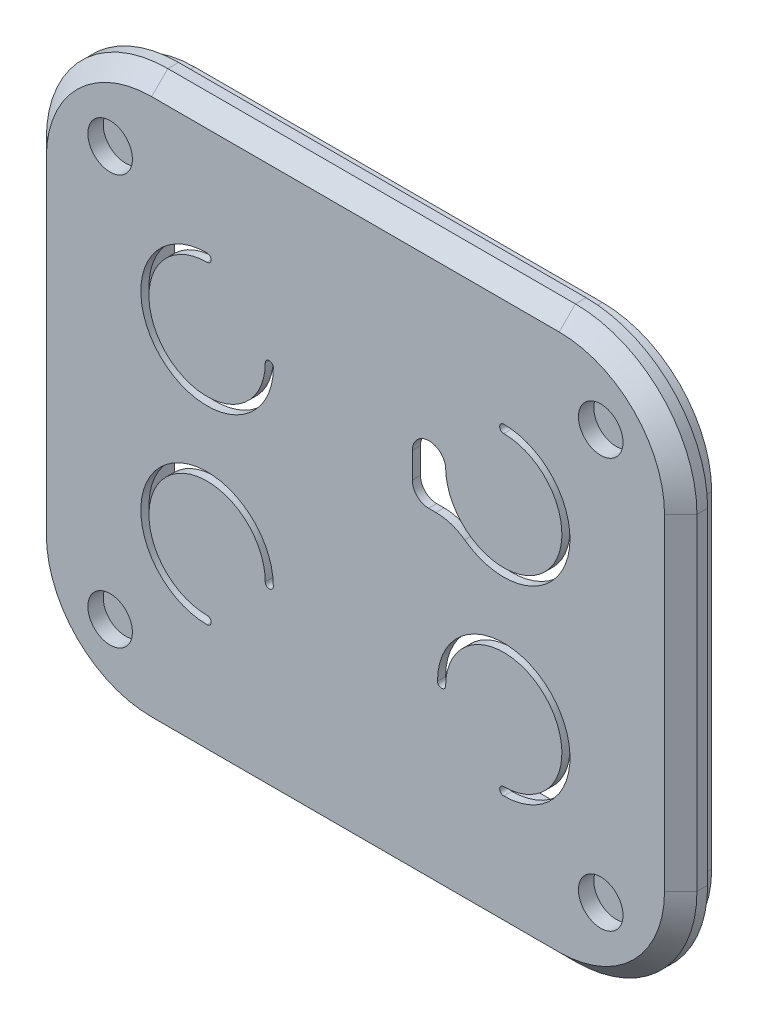
from build123d import *

# Parameters (mm, degrees)
FLEXTURE_DEPTH                 = 1
GENERAL_START                  = -4.32
GENERAL_DEPTH                  = 4.32
CHANFREIN1_SIZE                = 2
ENL_V_MAT_EXTRU_1_DEPTH        = 2
ESQUISSE2_R                    = 1.75
PASSAGE_VIS_DEPTH              = 54.536972272
LAMAGE_START                   = -1
ESQUISSE2_3_R                  = 2.75
LAMAGE_VIS_DEPTH               = 1.9
ESQUISSE3_R                    = 2.75
IMPRESSIONBRIDGE_DEPTH         = 0.4
SYM_TRIE_2_VIS_COPY_1_SKETCH_R = 1.75
SYM_TRIE_2_VIS_COPY_1_DEPTH    = 54.536972272
SYM_TRIE_START                 = -1
SYM_TRIE_2_VIS_COPY_2_SKETCH_R = 2.75
SYM_TRIE_2_VIS_COPY_2_DEPTH    = 1.9
SYM_TRIE_2_VIS_COPY_3_SKETCH_R = 2.75
SYM_TRIE_2_VIS_COPY_3_DEPTH    = 0.4


with BuildPart() as part:
    # Esquisse1 → Flexture (new body)
    with BuildSketch(Plane.XY):
        with BuildLine():
            ThreePointArc((40.15, 20.15), (35.756601718, 30.756601718), (25.15, 35.15))
            Line((25.15, 35.15), (-25.15, 35.15))
            ThreePointArc((-25.15, 35.15), (-35.756601718, 30.756601718), (-40.15, 20.15))
            Line((-40.15, 20.15), (-40.15, -20.15))
            ThreePointArc((-40.15, -20.15), (-35.756601718, -30.756601718), (-25.15, -35.15))
            Line((-25.15, -35.15), (25.15, -35.15))
            ThreePointArc((25.15, -35.15), (35.756601718, -30.756601718), (40.15, -20.15))
            Line((40.15, -20.15), (40.15, 20.15))
        make_face()
        with BuildLine():
            Line((9.944420337, 6.246632211), (9.024077951, 6.246632211))
            ThreePointArc((9.024077951, 6.246632211), (7.609864388, 6.832418648), (7.024077951, 8.246632211))
            Line((7.024077951, 8.246632211), (7.024077951, 11.421689431))
            ThreePointArc((7.024077951, 11.421689431), (8.90907126, 13.478916909), (11.122855622, 11.780522528))
            ThreePointArc((11.122855622, 11.780522528), (11.128556545, 11.737248439), (11.130461693, 11.693642044))
            ThreePointArc((11.130461693, 11.693642044), (23.380482865, 6.619517135), (18.306357956, 18.869538307))
            ThreePointArc((18.306357956, 18.869538307), (17.806357956, 19.369538307), (18.306357956, 19.869538307))
            ThreePointArc((18.306357956, 19.869538307), (26.07883242, 9.157124665), (13.483641052, 5.091621037))
            ThreePointArc((13.483641052, 5.091621037), (11.805880388, 5.950575275), (9.944420337, 6.246632211))
        make_face(mode=Mode.SUBTRACT)
        with BuildLine():
            ThreePointArc((-18.306357956, -18.869538307), (-17.806357956, -19.369538307), (-18.306357956, -19.869538307))
            ThreePointArc((-18.306357956, -19.869538307), (-24.087589646, -5.912410354), (-10.130461693, -11.693642044))
            ThreePointArc((-10.130461693, -11.693642044), (-10.630461693, -12.193642044), (-11.130461693, -11.693642044))
            ThreePointArc((-11.130461693, -11.693642044), (-23.380482865, -6.619517135), (-18.306357956, -18.869538307))
        make_face(mode=Mode.SUBTRACT)
        with BuildLine():
            ThreePointArc((11.130461693, -11.693642044), (10.630461693, -12.193642044), (10.130461693, -11.693642044))
            ThreePointArc((10.130461693, -11.693642044), (24.087589646, -5.912410354), (18.306357956, -19.869538307))
            ThreePointArc((18.306357956, -19.869538307), (17.806357956, -19.369538307), (18.306357956, -18.869538307))
            ThreePointArc((18.306357956, -18.869538307), (23.380482865, -6.619517135), (11.130461693, -11.693642044))
        make_face(mode=Mode.SUBTRACT)
        with BuildLine():
            ThreePointArc((-18.306357956, 18.869538307), (-23.380482865, 6.619517135), (-11.130461693, 11.693642044))
            ThreePointArc((-11.130461693, 11.693642044), (-10.630461693, 12.193642044), (-10.130461693, 11.693642044))
            ThreePointArc((-10.130461693, 11.693642044), (-24.087589646, 5.912410354), (-18.306357956, 19.869538307))
            ThreePointArc((-18.306357956, 19.869538307), (-17.806357956, 19.369538307), (-18.306357956, 18.869538307))
        make_face(mode=Mode.SUBTRACT)
    extrude(amount=FLEXTURE_DEPTH)

    # Esquisse1<6> → General (add)
    with BuildSketch(Plane.XY.offset(GENERAL_START)):
        with BuildLine():
            Line((25.15, 35.15), (-25.15, 35.15))
            ThreePointArc((-25.15, 35.15), (-35.756601718, 30.756601718), (-40.15, 20.15))
            Line((-40.15, 20.15), (-40.15, -20.15))
            ThreePointArc((-40.15, -20.15), (-35.756601718, -30.756601718), (-25.15, -35.15))
            Line((-25.15, -35.15), (25.15, -35.15))
            ThreePointArc((25.15, -35.15), (35.756601718, -30.756601718), (40.15, -20.15))
            Line((40.15, -20.15), (40.15, 20.15))
            ThreePointArc((40.15, 20.15), (35.756601718, 30.756601718), (25.15, 35.15))
        make_face()
        with BuildLine():
            Line((-27.65, 20.15), (-27.65, -20.15))
            ThreePointArc((-27.65, -20.15), (-26.917766953, -21.917766953), (-25.15, -22.65))
            Line((-25.15, -22.65), (25.15, -22.65))
            ThreePointArc((25.15, -22.65), (26.917766953, -21.917766953), (27.65, -20.15))
            Line((27.65, -20.15), (27.65, 20.15))
            ThreePointArc((27.65, 20.15), (26.917766953, 21.917766953), (25.15, 22.65))
            Line((25.15, 22.65), (-25.15, 22.65))
            ThreePointArc((-25.15, 22.65), (-26.917766953, 21.917766953), (-27.65, 20.15))
        make_face(mode=Mode.SUBTRACT)
    extrude(amount=GENERAL_DEPTH)

    # Chanfrein1
    chanfrein1_edges = [part.edges().sort_by_distance(p)[0] for p in [
        (35.756601718, 30.756601718, 1),
        (0, 35.15, 1),
        (-35.756601718, 30.756601718, 1),
        (-40.15, 0, 1),
        (-35.756601718, -30.756601718, 1),
        (0, -35.15, 1),
        (35.756601718, -30.756601718, 1),
        (40.15, 0, 1),
    ]]
    chamfer(chanfrein1_edges, length=CHANFREIN1_SIZE)

    # Esquisse4 → Enlèv. mat.-Extru.1 (cut)
    with BuildSketch(Plane(origin=(0, 0, -4.32), x_dir=(-1, 0, 0), z_dir=(0, 0, -1))):
        with BuildLine():
            Line((-40.15, -20.15), (-40.15, 20.15))
            ThreePointArc((-40.15, 20.15), (-35.756601718, 30.756601718), (-25.15, 35.15))
            Line((-25.15, 35.15), (25.15, 35.15))
            ThreePointArc((25.15, 35.15), (35.756601718, 30.756601718), (40.15, 20.15))
            Line((40.15, 20.15), (40.15, -20.15))
            ThreePointArc((40.15, -20.15), (35.756601718, -30.756601718), (25.15, -35.15))
            Line((25.15, -35.15), (-25.15, -35.15))
            ThreePointArc((-25.15, -35.15), (-35.756601718, -30.756601718), (-40.15, -20.15))
        make_face()
        with BuildLine():
            Line((25.15, -33.65), (-25.15, -33.65))
            ThreePointArc((-25.15, -33.65), (-34.695941546, -29.695941546), (-38.65, -20.15))
            Line((-38.65, -20.15), (-38.65, 20.15))
            ThreePointArc((-38.65, 20.15), (-34.695941546, 29.695941546), (-25.15, 33.65))
            Line((-25.15, 33.65), (25.15, 33.65))
            ThreePointArc((25.15, 33.65), (34.695941546, 29.695941546), (38.65, 20.15))
            Line((38.65, 20.15), (38.65, -20.15))
            ThreePointArc((38.65, -20.15), (34.695941546, -29.695941546), (25.15, -33.65))
        make_face(mode=Mode.SUBTRACT)
    extrude(amount=-ENL_V_MAT_EXTRU_1_DEPTH, mode=Mode.SUBTRACT)

    # Esquisse2 → Passage vis (cut, through all)
    with BuildSketch(Plane(origin=(0, 0, 0), x_dir=(-1, 0, 0), z_dir=(0, 0, -1))):
        with Locations((-30.276524164, 25.276524164)):
            Circle(ESQUISSE2_R)
    passage_vis = extrude(amount=PASSAGE_VIS_DEPTH, mode=Mode.SUBTRACT)

    # Esquisse2<3> → Lamage vis (cut)
    with BuildSketch(Plane(origin=(0, 0, 0), x_dir=(-1, 0, 0), z_dir=(0, 0, -1)).offset(LAMAGE_START)):
        with Locations(Location((-30.276524164, 25.276524164, 0), (0, 0, 180))):
            Circle(ESQUISSE2_3_R)
    lamage_vis = extrude(amount=LAMAGE_VIS_DEPTH, mode=Mode.SUBTRACT)

    # Esquisse3 → ImpressionBridge (add)
    with BuildSketch(Plane.XY.offset(-0.9)):
        with Locations((30.276524164, 25.276524164)):
            Circle(ESQUISSE3_R)
    impressionbridge = extrude(amount=-IMPRESSIONBRIDGE_DEPTH)

    # Symétrie vis: Passage vis, Lamage vis, ImpressionBridge across plane
    add(passage_vis.mirror(Plane(origin=(0, 0, 0), x_dir=(0, 0, 1), z_dir=(1, 0, 0))), mode=Mode.SUBTRACT)
    add(lamage_vis.mirror(Plane(origin=(0, 0, 0), x_dir=(0, 0, 1), z_dir=(1, 0, 0))), mode=Mode.SUBTRACT)
    add(impressionbridge.mirror(Plane(origin=(0, 0, 0), x_dir=(0, 0, 1), z_dir=(1, 0, 0))))

    # Symétrie 2 vis: Passage vis, Lamage vis, ImpressionBridge across plane
    add(passage_vis.mirror(Plane.ZX), mode=Mode.SUBTRACT)
    add(lamage_vis.mirror(Plane.ZX), mode=Mode.SUBTRACT)
    add(impressionbridge.mirror(Plane.ZX))

    # Symétrie 2 vis copy 1 sketch → Symétrie 2 vis copy 1 (cut, through all)
    with BuildSketch(Plane(origin=(0, 0, 0), x_dir=(1, 0, 0), z_dir=(0, 0, -1))):
        with Locations((-30.276524164, 25.276524164)):
            Circle(SYM_TRIE_2_VIS_COPY_1_SKETCH_R)
    extrude(amount=SYM_TRIE_2_VIS_COPY_1_DEPTH, mode=Mode.SUBTRACT)

    # Symétrie 2 vis copy 2 sketch → Symétrie 2 vis copy 2 (cut)
    with BuildSketch(Plane(origin=(0, 0, 0), x_dir=(1, 0, 0), z_dir=(0, 0, -1)).offset(SYM_TRIE_START)):
        with Locations(Location((-30.276524164, 25.276524164, 0), (0, 0, 180))):
            Circle(SYM_TRIE_2_VIS_COPY_2_SKETCH_R)
    extrude(amount=SYM_TRIE_2_VIS_COPY_2_DEPTH, mode=Mode.SUBTRACT)

    # Symétrie 2 vis copy 3 sketch → Symétrie 2 vis copy 3 (add)
    with BuildSketch(Plane(origin=(0, 0, -0.9), x_dir=(-1, 0, 0), z_dir=(0, 0, 1))):
        with Locations((30.276524164, 25.276524164)):
            Circle(SYM_TRIE_2_VIS_COPY_3_SKETCH_R)
    extrude(amount=-SYM_TRIE_2_VIS_COPY_3_DEPTH)


solid = part.part
